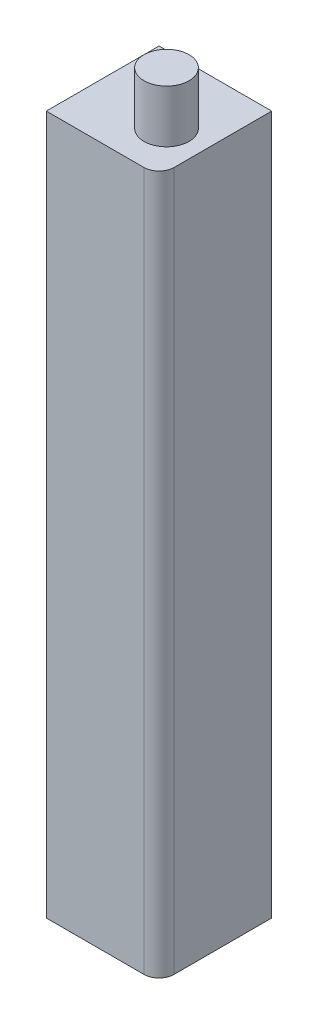
from build123d import *

# Parameters (mm, degrees)
SKETCH1_W           = 15
SKETCH1_H           = 15
BOSS_EXTRUDE1_DEPTH = 93
SKETCH2_R           = 3
BOSS_EXTRUDE2_DEPTH = 7
FILLET1_R           = 2


with BuildPart() as part:
    # Sketch1 → Boss-Extrude1 (new body)
    with BuildSketch(Plane(origin=(0, 0, 0), x_dir=(1, 0, 0), z_dir=(0, 1, 0))):
        Rectangle(SKETCH1_W, SKETCH1_H)
    extrude(amount=BOSS_EXTRUDE1_DEPTH)

    # Sketch2 → Boss-Extrude2 (add)
    with BuildSketch(Plane(origin=(0, 93, 0), x_dir=(1, 0, 0), z_dir=(0, 1, 0))):
        with Locations(Location((2.5, -1.5, 0), (0, 0, 270))):
            Circle(SKETCH2_R)
    extrude(amount=BOSS_EXTRUDE2_DEPTH)

    # Fillet1
    fillet1_edges = [part.edges().sort_by_distance(p)[0] for p in [
        (7.5, 46.5, 7.5),
    ]]
    fillet(fillet1_edges, radius=FILLET1_R)


solid = part.part
